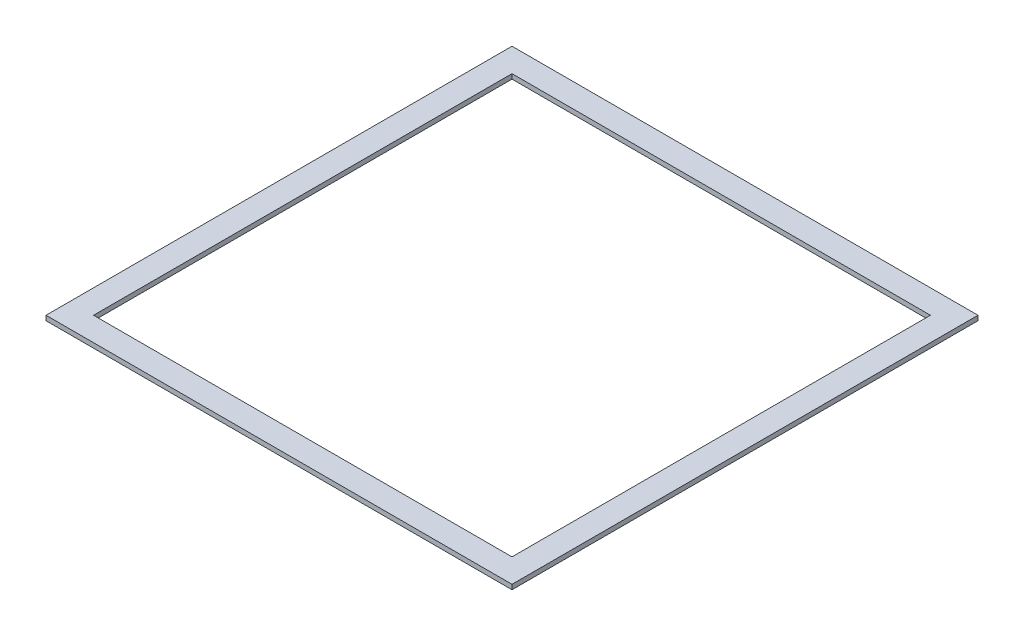
from build123d import *

# Parameters (mm, degrees)
CROQUIS1_W              = 98
CROQUIS1_H              = 98
CROQUIS1_W_2            = 88
CROQUIS1_H_2            = 88
SALIENTE_EXTRUIR1_DEPTH = 1


with BuildPart() as part:
    # Croquis1 → Saliente-Extruir1 (new body)
    with BuildSketch(Plane(origin=(0, 0, 0), x_dir=(1, 0, 0), z_dir=(0, 1, 0))):
        with Locations((49, 49)):
            Rectangle(CROQUIS1_W, CROQUIS1_H)
        with Locations((49, 49)):
            Rectangle(CROQUIS1_W_2, CROQUIS1_H_2, mode=Mode.SUBTRACT)
    extrude(amount=SALIENTE_EXTRUIR1_DEPTH)


solid = part.part
